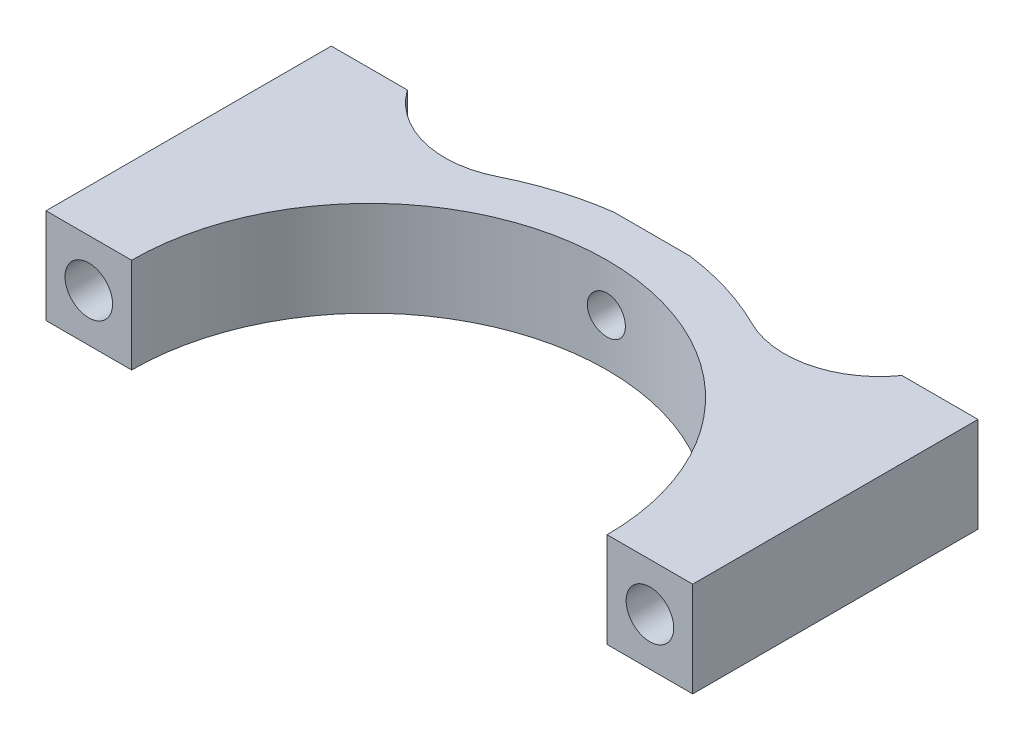
from build123d import *

# Parameters (mm, degrees)
EXTRUDE_1_DEPTH     = 10
SKETCH_2_R          = 2.5
SKETCH_2_R_2        = 2
CUT_EXTRUDE_1_DEPTH = 40


with BuildPart() as part:
    # 草图1 → 凸台-拉伸1 (new body)
    with BuildSketch(Plane(origin=(0, 0, 0), x_dir=(1, 0, 0), z_dir=(0, 1, 0))):
        with BuildLine():
            Line((-25, 0), (-34, 0))
            Line((-34, 0), (-34, 30))
            Line((-34, 30), (-26, 30))
            ThreePointArc((-26, 30), (-20.276357576, 26.094481357), (-13.388178788, 26.846911717))
            ThreePointArc((-13.388178788, 26.846911717), (-8.812963312, 28.676326084), (-4, 29.732137495))
            Line((-4, 29.732137495), (4, 29.732137495))
            ThreePointArc((4, 29.732137495), (8.812963312, 28.676326084), (13.388178788, 26.846911717))
            ThreePointArc((13.388178788, 26.846911717), (20.276357576, 26.094481357), (26, 30))
            Line((26, 30), (34, 30))
            Line((34, 30), (34, 0))
            Line((34, 0), (25, 0))
            ThreePointArc((25, 0), (0, 25), (-25, 0))
        make_face()
    extrude(amount=EXTRUDE_1_DEPTH)

    # 草图2 → 切除-拉伸1 (cut)
    with BuildSketch(Plane(origin=(0, 0, -30), x_dir=(-1, 0, 0), z_dir=(0, 0, -1))):
        with Locations((-29.5, 5)):
            Circle(SKETCH_2_R)
        with Locations((29.5, 5)):
            Circle(SKETCH_2_R)
        with Locations((0, 5)):
            Circle(SKETCH_2_R_2)
    extrude(amount=-CUT_EXTRUDE_1_DEPTH, mode=Mode.SUBTRACT)


solid = part.part
